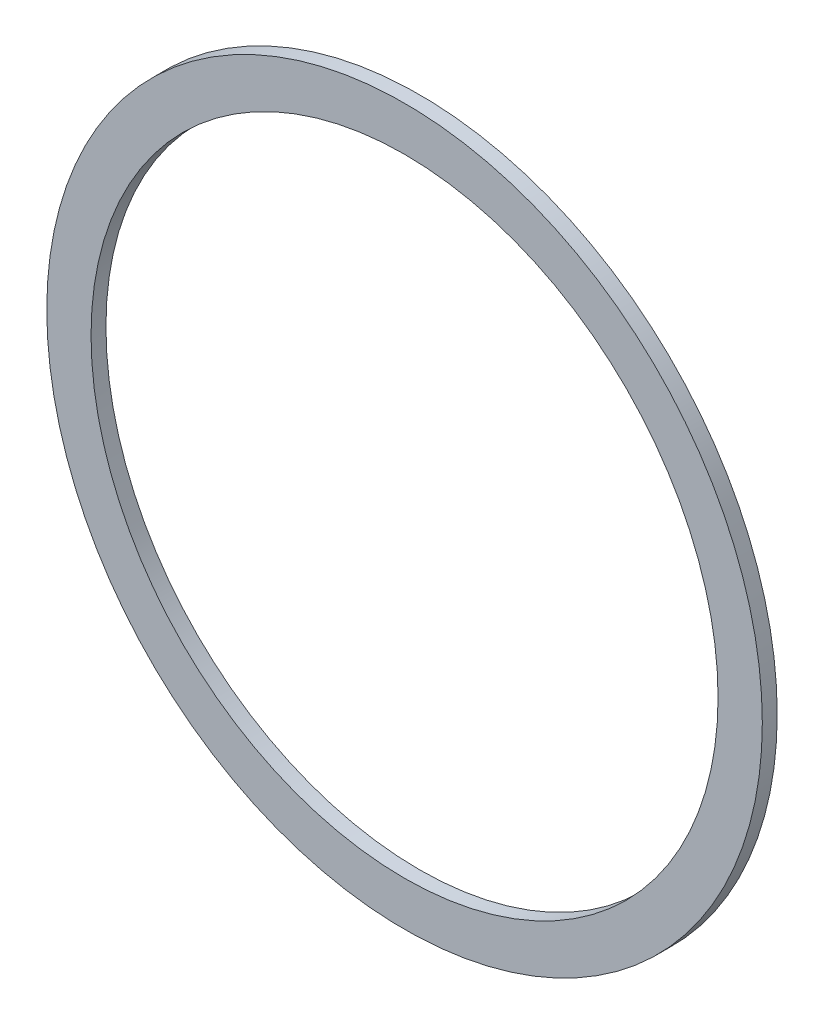
from build123d import *

# Parameters (mm, degrees)
SKETCH1_R          = 615.95
SKETCH1_R_2        = 539.75
BASE_EXTRUDE_DEPTH = 25.654


with BuildPart() as part:
    # Sketch1 → Base-Extrude (new body)
    with BuildSketch(Plane.XY):
        Circle(SKETCH1_R)
        Circle(SKETCH1_R_2, mode=Mode.SUBTRACT)
    extrude(amount=-BASE_EXTRUDE_DEPTH)


solid = part.part
